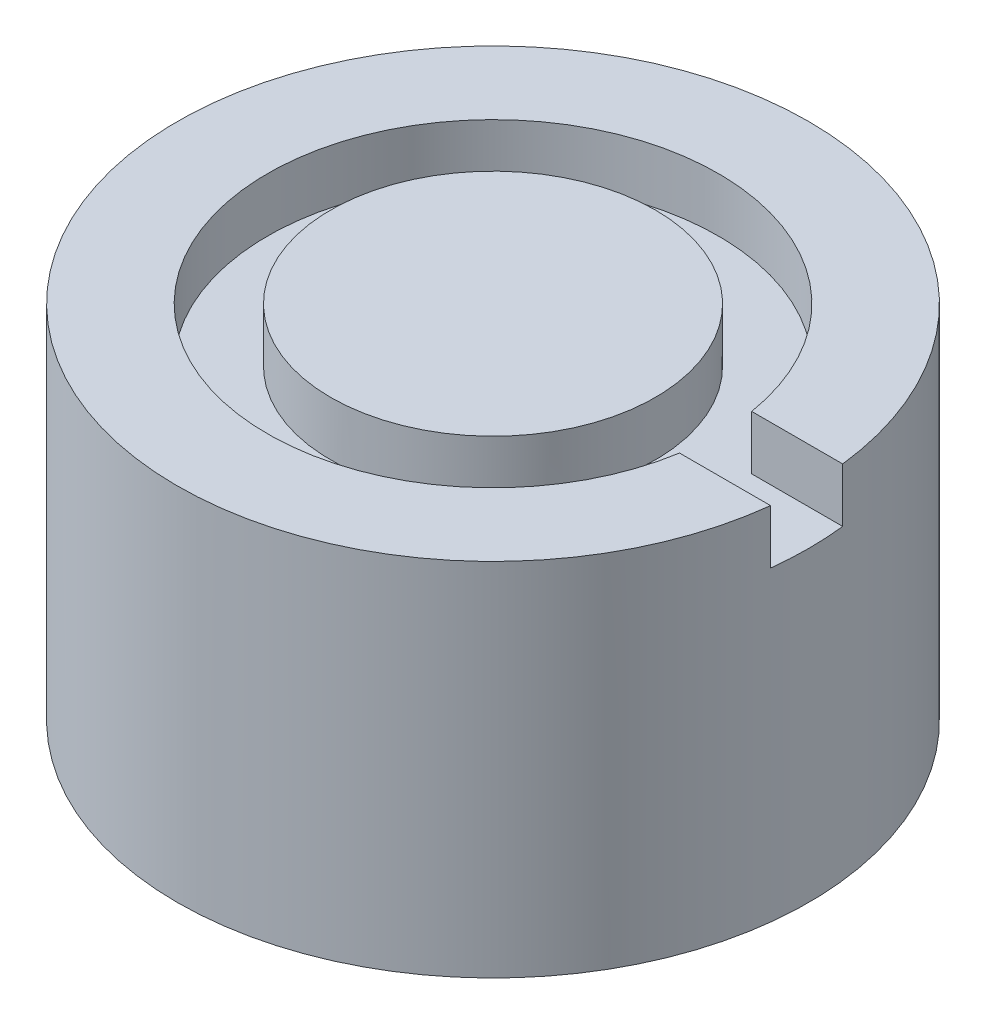
from build123d import *

# Parameters (mm, degrees)
SKETCH_1_R          = 6
SKETCH_1_R_2        = 3.05
EXTRUDE_1_DEPTH     = 9
SKETCH_2_R          = 9
EXTRUDE_2_DEPTH     = 3
SKETCH_3_W          = 0.9
SKETCH_3_H          = 8.759425964
EXTRUDE_3_DEPTH     = 1
EXTRUDE_START       = 10
SKETCH_4_R          = 12.5
SKETCH_4_R_2        = 6
EXTRUDE_4_DEPTH     = 10
EXTRUDE_START_2     = 7
SKETCH_5_R          = 12.5
SKETCH_5_R_2        = 11
EXTRUDE_5_DEPTH     = 7
SKETCH_6_R          = 17.5
SKETCH_6_R_2        = 12.5
EXTRUDE_6_DEPTH     = 20
SKETCH_7_W          = 11.223410854
SKETCH_7_H          = 4
CUT_EXTRUDE_1_DEPTH = 3


with BuildPart() as part:
    # 草图1 → 凸台-拉伸1 (new body)
    with BuildSketch(Plane(origin=(0, 0, 0), x_dir=(1, 0, 0), z_dir=(0, 1, 0))):
        with Locations(Location((0, 0, 0), (0, 0, 270))):
            Circle(SKETCH_1_R)
        with Locations(Location((0, 0, 0), (0, 0, 270))):
            Circle(SKETCH_1_R_2, mode=Mode.SUBTRACT)
    extrude(amount=EXTRUDE_1_DEPTH)

    # 草图2 → 凸台-拉伸2 (add)
    with BuildSketch(Plane(origin=(0, 9, 0), x_dir=(1, 0, 0), z_dir=(0, 1, 0))):
        with Locations(Location((0, 0, 0), (0, 0, 270))):
            Circle(SKETCH_2_R)
    extrude(amount=EXTRUDE_2_DEPTH)

    # 草图3 → 凸台-拉伸3 (add)
    with BuildSketch(Plane.XZ.offset(-9)):
        Rectangle(SKETCH_3_W, SKETCH_3_H)
    extrude(amount=EXTRUDE_3_DEPTH)

    # 草图4 → 凸台-拉伸4 (add)
    with BuildSketch(Plane.XZ.offset(-9).offset(EXTRUDE_START)):
        with Locations(Location((0, 0, 0), (0, 0, 270))):
            Circle(SKETCH_4_R)
        with Locations(Location((0, 0, 0), (0, 0, 90))):
            Circle(SKETCH_4_R_2, mode=Mode.SUBTRACT)
    extrude(amount=-EXTRUDE_4_DEPTH)

    # 草图5 → 凸台-拉伸5 (add)
    with BuildSketch(Plane.XZ.offset(1).offset(EXTRUDE_START_2)):
        with Locations(Location((0, 0, 0), (0, 0, 270))):
            Circle(SKETCH_5_R)
        with Locations(Location((0, 0, 0), (0, 0, 270))):
            Circle(SKETCH_5_R_2, mode=Mode.SUBTRACT)
    extrude(amount=-EXTRUDE_5_DEPTH)

    # 草图6 → 凸台-拉伸6 (add)
    with BuildSketch(Plane.XZ.offset(8)):
        with Locations(Location((0, 0, 0), (0, 0, 270))):
            Circle(SKETCH_6_R)
        with Locations(Location((0, 0, 0), (0, 0, 270))):
            Circle(SKETCH_6_R_2, mode=Mode.SUBTRACT)
    extrude(amount=-EXTRUDE_6_DEPTH)

    # 草图7 → 切除-拉伸1 (cut)
    with BuildSketch(Plane(origin=(0, 12, 0), x_dir=(1, 0, 0), z_dir=(0, 1, 0))):
        with Locations((17.5, 0)):
            Rectangle(SKETCH_7_W, SKETCH_7_H)
    extrude(amount=-CUT_EXTRUDE_1_DEPTH, mode=Mode.SUBTRACT)


solid = part.part
